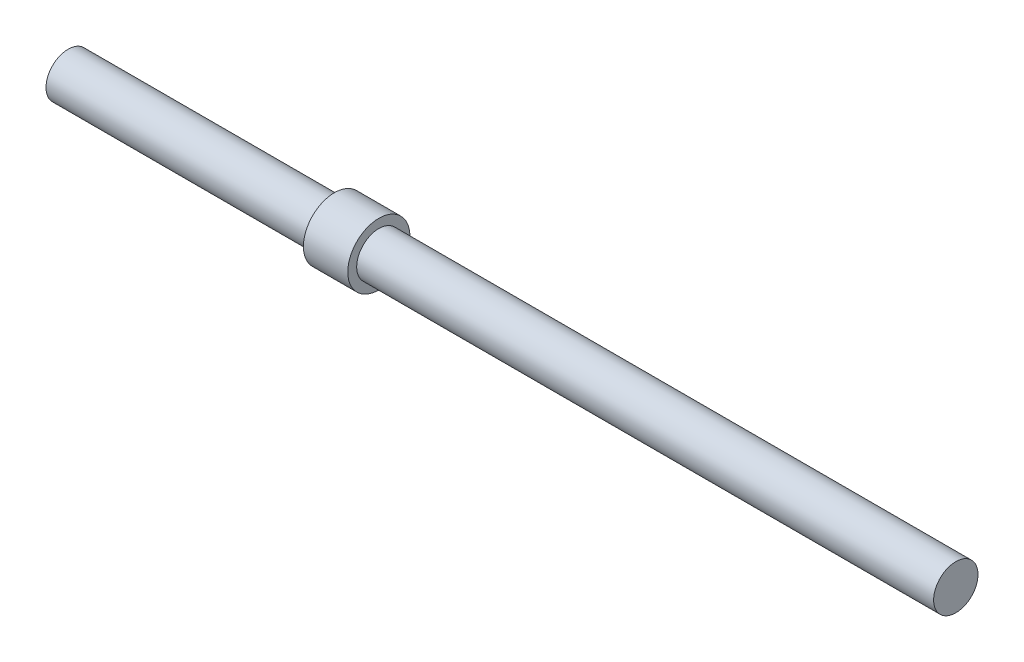
from build123d import *

# Parameters (mm, degrees)
SKETCH1_R           = 5
BOSS_EXTRUDE1_DEPTH = 100
BOSS_EXTRUDE2_START = -70
SKETCH2_R           = 7
BOSS_EXTRUDE2_DEPTH = 10


with BuildPart() as part:
    # Sketch1 → Boss-Extrude1 (new, symmetric)
    with BuildSketch(Plane(origin=(0, 0, 0), x_dir=(0, 0, -1), z_dir=(1, 0, 0))):
        Circle(SKETCH1_R)
    extrude(amount=BOSS_EXTRUDE1_DEPTH, both=True)

    # Sketch2 → Boss-Extrude2 (add)
    with BuildSketch(Plane.ZY.offset(100).offset(BOSS_EXTRUDE2_START)):
        Circle(SKETCH2_R)
    extrude(amount=BOSS_EXTRUDE2_DEPTH)


solid = part.part
